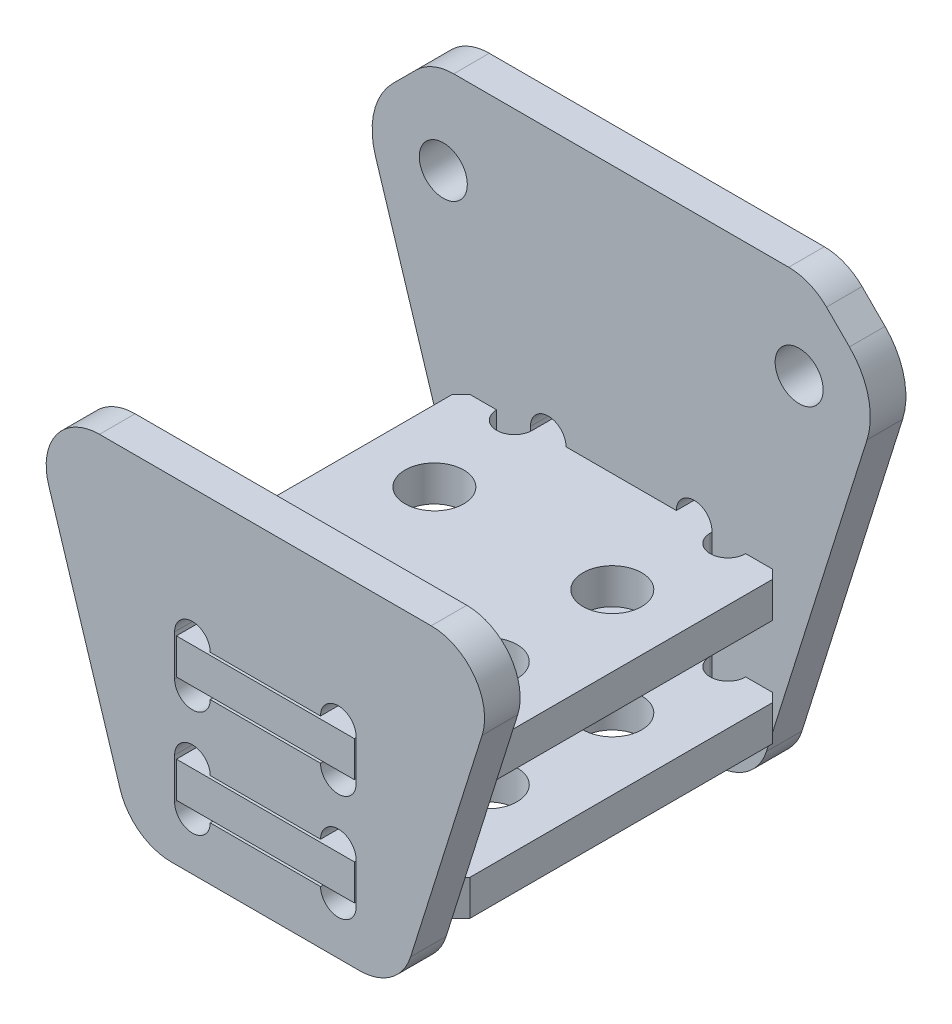
from build123d import *

# Parameters (mm, degrees)
SKETCH_1_R             = 1.35
EXTRUDE_1_DEPTH        = 2
FILLET_1_R             = 3
SKETCH_2_R             = 1.65
EXTRUDE_2_DEPTH        = 1
CHAMFER_1_SIZE         = 0.5
PATTERN_LINEAR_1_COUNT = 2
PATTERN_LINEAR_1_PITCH = 6
EXTRUDE_3_DEPTH        = 2
FILLET_2_R             = 3


with BuildPart() as part:
    # 草图1 → 凸台-拉伸1 (new body)
    with BuildSketch(Plane.XY):
        with BuildLine():
            Line((-10.656854249, 5), (-12.828427125, 2.828427125))
            ThreePointArc((-12.828427125, 2.828427125), (-13.88489981, 0.952656008), (-13.816050122, -1.199066916))
            Line((-13.816050122, -1.199066916), (-7.5, -21.3))
            Line((-7.5, -21.3), (7.5, -21.3))
            Line((7.5, -21.3), (13.816050122, -1.199066916))
            ThreePointArc((13.816050122, -1.199066916), (13.88489981, 0.952656008), (12.828427125, 2.828427125))
            Line((12.828427125, 2.828427125), (10.656854249, 5))
            Line((10.656854249, 5), (-10.656854249, 5))
        make_face()
        with BuildLine():
            Line((-5.1, -12.3), (-5.1, -10))
            ThreePointArc((-5.1, -10), (-4.1, -9), (-3.1, -10))
            Line((-3.1, -10), (3.1, -10))
            ThreePointArc((3.1, -10), (4.1, -9), (5.1, -10))
            Line((5.1, -10), (5.1, -12.3))
            ThreePointArc((5.1, -12.3), (4.1, -13.3), (3.1, -12.3))
            Line((3.1, -12.3), (-3.1, -12.3))
            ThreePointArc((-3.1, -12.3), (-4.1, -13.3), (-5.1, -12.3))
        make_face(mode=Mode.SUBTRACT)
        with BuildLine():
            Line((-5.1, -18.3), (-5.1, -16))
            ThreePointArc((-5.1, -16), (-4.1, -15), (-3.1, -16))
            Line((-3.1, -16), (3.1, -16))
            ThreePointArc((3.1, -16), (4.1, -15), (5.1, -16))
            Line((5.1, -16), (5.1, -18.3))
            ThreePointArc((5.1, -18.3), (4.1, -19.3), (3.1, -18.3))
            Line((3.1, -18.3), (-3.1, -18.3))
            ThreePointArc((-3.1, -18.3), (-4.1, -19.3), (-5.1, -18.3))
        make_face(mode=Mode.SUBTRACT)
        with Locations((-10, 0)):
            Circle(SKETCH_1_R, mode=Mode.SUBTRACT)
        with Locations((10, 0)):
            Circle(SKETCH_1_R, mode=Mode.SUBTRACT)
    extrude(amount=EXTRUDE_1_DEPTH)

    # 圆角1
    fillet_1_edges = [part.edges().sort_by_distance(p)[0] for p in [
        (7.5, -21.3, 1),
        (-7.5, -21.3, 1),
        (-10.656854249, 5, 1),
        (10.656854249, 5, 1),
    ]]
    fillet(fillet_1_edges, radius=FILLET_1_R)


with BuildPart() as body_2:
    # 草图2 → 凸台-拉伸2 (new, symmetric)
    with BuildSketch(Plane(origin=(0, -11.15, 0), x_dir=(-1, 0, 0), z_dir=(0, -1, 0))):
        with BuildLine():
            Line((5, -2), (5, 0))
            Line((5, 0), (-5, 0))
            Line((-5, 0), (-5, -2))
            ThreePointArc((-5, -2), (-6, -3), (-7, -2))
            Line((-7, -2), (-9, -2))
            Line((-9, -2), (-9, -20))
            Line((-9, -20), (-7, -20))
            ThreePointArc((-7, -20), (-6, -19), (-5, -20))
            Line((-5, -20), (-5, -22))
            Line((-5, -22), (5, -22))
            Line((5, -22), (5, -20))
            ThreePointArc((5, -20), (6, -19), (7, -20))
            Line((7, -20), (9, -20))
            Line((9, -20), (9, -2))
            Line((9, -2), (7, -2))
            ThreePointArc((7, -2), (6, -3), (5, -2))
        make_face()
        with Locations(Location((-5, -7.5, 0), (0, 0, 90))):
            Circle(SKETCH_2_R, mode=Mode.SUBTRACT)
        with Locations(Location((-5, -14.5, 0), (0, 0, 270))):
            Circle(SKETCH_2_R, mode=Mode.SUBTRACT)
        with Locations(Location((5, -14.5, 0), (0, 0, 90))):
            Circle(SKETCH_2_R, mode=Mode.SUBTRACT)
        with Locations(Location((5, -7.5, 0), (0, 0, 270))):
            Circle(SKETCH_2_R, mode=Mode.SUBTRACT)
    extrude(amount=EXTRUDE_2_DEPTH, both=True)

    # 倒角1
    chamfer_1_edges = [body_2.edges().sort_by_distance(p)[0] for p in [
        (-9, -11.15, 2),
        (-9, -11.15, 20),
        (9, -11.15, 20),
        (9, -11.15, 2),
    ]]
    chamfer(chamfer_1_edges, length=CHAMFER_1_SIZE)


with BuildPart() as pattern_linear_1_1:
    # 阵列(线性)1: pattern copy
    add(body_2.part.moved(Location(Vector(0, -1, 0) * (1 * PATTERN_LINEAR_1_PITCH))))


with BuildPart() as body_4:
    # 草图3 → 凸台-拉伸3 (new body)
    with BuildSketch(Plane.XY.offset(22)):
        with BuildLine():
            Line((-5.298037503, -21.3), (5.298037503, -21.3))
            ThreePointArc((5.298037503, -21.3), (7.073157139, -20.718460312), (8.160075095, -19.199300187))
            Line((8.160075095, -19.199300187), (13.407275139, -2.5))
            Line((13.407275139, -2.5), (-13.407275139, -2.5))
            Line((-13.407275139, -2.5), (-8.160075095, -19.199300187))
            ThreePointArc((-8.160075095, -19.199300187), (-7.073157139, -20.718460312), (-5.298037503, -21.3))
        make_face()
        with BuildLine():
            Line((-5.1, -18.3), (-5.1, -16))
            ThreePointArc((-5.1, -16), (-4.1, -15), (-3.1, -16))
            Line((-3.1, -16), (3.1, -16))
            ThreePointArc((3.1, -16), (4.1, -15), (5.1, -16))
            Line((5.1, -16), (5.1, -18.3))
            ThreePointArc((5.1, -18.3), (4.1, -19.3), (3.1, -18.3))
            Line((3.1, -18.3), (-3.1, -18.3))
            ThreePointArc((-3.1, -18.3), (-4.1, -19.3), (-5.1, -18.3))
        make_face(mode=Mode.SUBTRACT)
        with BuildLine():
            Line((-3.1, -10), (3.1, -10))
            ThreePointArc((3.1, -10), (4.1, -9), (5.1, -10))
            Line((5.1, -10), (5.1, -12.3))
            ThreePointArc((5.1, -12.3), (4.1, -13.3), (3.1, -12.3))
            Line((3.1, -12.3), (-3.1, -12.3))
            ThreePointArc((-3.1, -12.3), (-4.1, -13.3), (-5.1, -12.3))
            Line((-5.1, -12.3), (-5.1, -10))
            ThreePointArc((-5.1, -10), (-4.1, -9), (-3.1, -10))
        make_face(mode=Mode.SUBTRACT)
    extrude(amount=-EXTRUDE_3_DEPTH)

    # 圆角2
    fillet_2_edges = [body_4.edges().sort_by_distance(p)[0] for p in [
        (-13.407275139, -2.5, 21),
        (13.407275139, -2.5, 21),
    ]]
    fillet(fillet_2_edges, radius=FILLET_2_R)


solid = Compound([part.part, body_2.part, pattern_linear_1_1.part, body_4.part])
